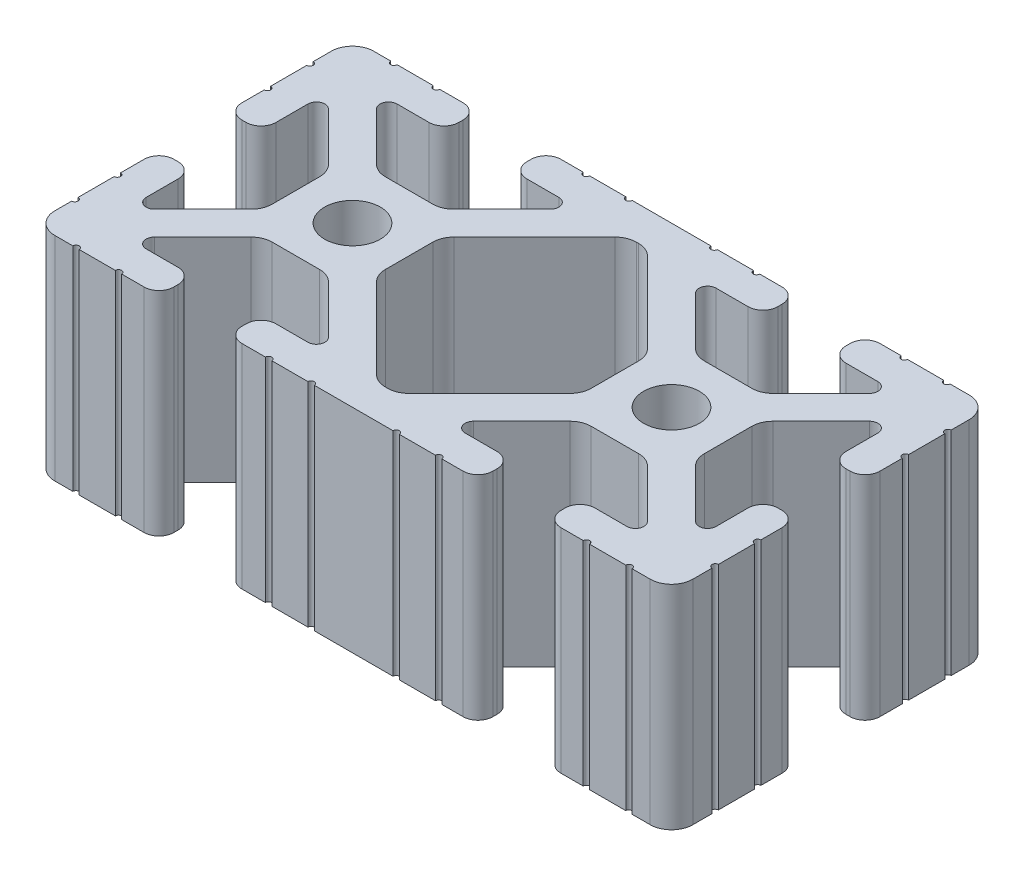
from build123d import *

# Parameters (mm, degrees)
SKETCH1_R           = 3.3274
BOSS_EXTRUDE1_DEPTH = 25.4


with BuildPart() as part:
    # Sketch1 → Boss-Extrude1 (new body)
    with BuildSketch(Plane(origin=(0, 0, 0), x_dir=(1, 0, 0), z_dir=(0, 1, 0))):
        with BuildLine():
            Line((27.420784407, 19.05), (24.892, 19.05))
            ThreePointArc((24.892, 19.05), (23.634764143, 18.529235857), (23.114, 17.272))
            Line((23.114, 17.272), (23.114, 16.764))
            ThreePointArc((23.114, 16.764), (23.634764143, 15.506764143), (24.892, 14.986))
            Line((24.892, 14.986), (28.709477062, 14.986))
            ThreePointArc((28.709477062, 14.986), (29.648138667, 14.358806367), (29.427897552, 13.25157951))
            Line((29.427897552, 13.25157951), (23.676666817, 7.500348776))
            ThreePointArc((23.676666817, 7.500348776), (22.852631511, 6.949745987), (21.880615593, 6.7564))
            Line((21.880615593, 6.7564), (16.219384407, 6.7564))
            ThreePointArc((16.219384407, 6.7564), (15.247368489, 6.949745987), (14.423333183, 7.500348776))
            Line((14.423333183, 7.500348776), (8.672102448, 13.25157951))
            ThreePointArc((8.672102448, 13.25157951), (8.451861333, 14.358806367), (9.390522938, 14.986))
            Line((9.390522938, 14.986), (13.208, 14.986))
            ThreePointArc((13.208, 14.986), (14.465235857, 15.506764143), (14.986, 16.764))
            Line((14.986, 16.764), (14.986, 17.272))
            ThreePointArc((14.986, 17.272), (14.465235857, 18.529235857), (13.208, 19.05))
            Line((13.208, 19.05), (10.541, 19.05))
            ThreePointArc((10.541, 19.05), (10.16, 18.669), (9.779, 19.05))
            Line((9.779, 19.05), (5.461, 19.05))
            ThreePointArc((5.461, 19.05), (5.08, 18.669), (4.699, 19.05))
            Line((4.699, 19.05), (-4.699, 19.05))
            ThreePointArc((-4.699, 19.05), (-5.08, 18.669), (-5.461, 19.05))
            Line((-5.461, 19.05), (-9.779, 19.05))
            ThreePointArc((-9.779, 19.05), (-10.16, 18.669), (-10.541, 19.05))
            Line((-10.541, 19.05), (-13.208, 19.05))
            ThreePointArc((-13.208, 19.05), (-14.465235857, 18.529235857), (-14.986, 17.272))
            Line((-14.986, 17.272), (-14.986, 16.764))
            ThreePointArc((-14.986, 16.764), (-14.465235857, 15.506764143), (-13.208, 14.986))
            Line((-13.208, 14.986), (-9.390522938, 14.986))
            ThreePointArc((-9.390522938, 14.986), (-8.451861333, 14.358806367), (-8.672102448, 13.25157951))
            Line((-8.672102448, 13.25157951), (-14.423333183, 7.500348776))
            ThreePointArc((-14.423333183, 7.500348776), (-15.247368489, 6.949745987), (-16.219384407, 6.7564))
            Line((-16.219384407, 6.7564), (-21.880615593, 6.7564))
            ThreePointArc((-21.880615593, 6.7564), (-22.852631511, 6.949745987), (-23.676666817, 7.500348776))
            Line((-23.676666817, 7.500348776), (-29.427897552, 13.25157951))
            ThreePointArc((-29.427897552, 13.25157951), (-29.648138667, 14.358806367), (-28.709477062, 14.986))
            Line((-28.709477062, 14.986), (-24.892, 14.986))
            ThreePointArc((-24.892, 14.986), (-23.634764143, 15.506764143), (-23.114, 16.764))
            Line((-23.114, 16.764), (-23.114, 17.272))
            ThreePointArc((-23.114, 17.272), (-23.634764143, 18.529235857), (-24.892, 19.05))
            Line((-24.892, 19.05), (-27.697215593, 19.05))
            ThreePointArc((-27.697215593, 19.05), (-28.078215593, 18.669), (-28.459215593, 19.05))
            Line((-28.459215593, 19.05), (-32.777215593, 19.05))
            ThreePointArc((-32.777215593, 19.05), (-33.158215593, 18.669), (-33.539215593, 19.05))
            Line((-33.539215593, 19.05), (-35.56, 19.05))
            ThreePointArc((-35.56, 19.05), (-37.356051224, 18.306051224), (-38.1, 16.51))
            Line((-38.1, 16.51), (-38.1, 14.351))
            ThreePointArc((-38.1, 14.351), (-37.719, 13.97), (-38.1, 13.589))
            Line((-38.1, 13.589), (-38.1, 9.271))
            ThreePointArc((-38.1, 9.271), (-37.719, 8.89), (-38.1, 8.509))
            Line((-38.1, 8.509), (-38.1, 5.842))
            ThreePointArc((-38.1, 5.842), (-37.579235857, 4.584764143), (-36.322, 4.064))
            Line((-36.322, 4.064), (-35.814, 4.064))
            ThreePointArc((-35.814, 4.064), (-34.556764143, 4.584764143), (-34.036, 5.842))
            Line((-34.036, 5.842), (-34.036, 9.659477062))
            ThreePointArc((-34.036, 9.659477062), (-33.408806367, 10.598138667), (-32.30157951, 10.377897552))
            Line((-32.30157951, 10.377897552), (-26.550348776, 4.626666817))
            ThreePointArc((-26.550348776, 4.626666817), (-25.999745987, 3.802631511), (-25.8064, 2.830615593))
            Line((-25.8064, 2.830615593), (-25.8064, -2.830615593))
            ThreePointArc((-25.8064, -2.830615593), (-25.999745987, -3.802631511), (-26.550348776, -4.626666817))
            Line((-26.550348776, -4.626666817), (-32.30157951, -10.377897552))
            ThreePointArc((-32.30157951, -10.377897552), (-33.408806367, -10.598138667), (-34.036, -9.659477062))
            Line((-34.036, -9.659477062), (-34.036, -5.842))
            ThreePointArc((-34.036, -5.842), (-34.556764143, -4.584764143), (-35.814, -4.064))
            Line((-35.814, -4.064), (-36.322, -4.064))
            ThreePointArc((-36.322, -4.064), (-37.579235857, -4.584764143), (-38.1, -5.842))
            Line((-38.1, -5.842), (-38.1, -8.647215593))
            ThreePointArc((-38.1, -8.647215593), (-37.719, -9.028215593), (-38.1, -9.409215593))
            Line((-38.1, -9.409215593), (-38.1, -13.727215593))
            ThreePointArc((-38.1, -13.727215593), (-37.719, -14.108215593), (-38.1, -14.489215593))
            Line((-38.1, -14.489215593), (-38.1, -16.51))
            ThreePointArc((-38.1, -16.51), (-37.356051224, -18.306051224), (-35.56, -19.05))
            Line((-35.56, -19.05), (-33.401, -19.05))
            ThreePointArc((-33.401, -19.05), (-33.02, -18.669), (-32.639, -19.05))
            Line((-32.639, -19.05), (-28.321, -19.05))
            ThreePointArc((-28.321, -19.05), (-27.94, -18.669), (-27.559, -19.05))
            Line((-27.559, -19.05), (-24.892, -19.05))
            ThreePointArc((-24.892, -19.05), (-23.634764143, -18.529235857), (-23.114, -17.272))
            Line((-23.114, -17.272), (-23.114, -16.764))
            ThreePointArc((-23.114, -16.764), (-23.634764143, -15.506764143), (-24.892, -14.986))
            Line((-24.892, -14.986), (-28.709477062, -14.986))
            ThreePointArc((-28.709477062, -14.986), (-29.648138667, -14.358806367), (-29.427897552, -13.25157951))
            Line((-29.427897552, -13.25157951), (-23.676666817, -7.500348776))
            ThreePointArc((-23.676666817, -7.500348776), (-22.852631511, -6.949745987), (-21.880615593, -6.7564))
            Line((-21.880615593, -6.7564), (-16.219384407, -6.7564))
            ThreePointArc((-16.219384407, -6.7564), (-15.247368489, -6.949745987), (-14.423333183, -7.500348776))
            Line((-14.423333183, -7.500348776), (-8.672102448, -13.25157951))
            ThreePointArc((-8.672102448, -13.25157951), (-8.451861333, -14.358806367), (-9.390522938, -14.986))
            Line((-9.390522938, -14.986), (-13.208, -14.986))
            ThreePointArc((-13.208, -14.986), (-14.465235857, -15.506764143), (-14.986, -16.764))
            Line((-14.986, -16.764), (-14.986, -17.272))
            ThreePointArc((-14.986, -17.272), (-14.465235857, -18.529235857), (-13.208, -19.05))
            Line((-13.208, -19.05), (-10.402784407, -19.05))
            ThreePointArc((-10.402784407, -19.05), (-10.021784407, -18.669), (-9.640784407, -19.05))
            Line((-9.640784407, -19.05), (-5.322784407, -19.05))
            ThreePointArc((-5.322784407, -19.05), (-4.941784407, -18.669), (-4.560784407, -19.05))
            Line((-4.560784407, -19.05), (4.837215593, -19.05))
            ThreePointArc((4.837215593, -19.05), (5.218215593, -18.669), (5.599215593, -19.05))
            Line((5.599215593, -19.05), (9.917215593, -19.05))
            ThreePointArc((9.917215593, -19.05), (10.298215593, -18.669), (10.679215593, -19.05))
            Line((10.679215593, -19.05), (13.208, -19.05))
            ThreePointArc((13.208, -19.05), (14.465235857, -18.529235857), (14.986, -17.272))
            Line((14.986, -17.272), (14.986, -16.764))
            ThreePointArc((14.986, -16.764), (14.465235857, -15.506764143), (13.208, -14.986))
            Line((13.208, -14.986), (9.390522938, -14.986))
            ThreePointArc((9.390522938, -14.986), (8.451861333, -14.358806367), (8.672102448, -13.25157951))
            Line((8.672102448, -13.25157951), (14.423333183, -7.500348776))
            ThreePointArc((14.423333183, -7.500348776), (15.247368489, -6.949745987), (16.219384407, -6.7564))
            Line((16.219384407, -6.7564), (21.880615593, -6.7564))
            ThreePointArc((21.880615593, -6.7564), (22.852631511, -6.949745987), (23.676666817, -7.500348776))
            Line((23.676666817, -7.500348776), (29.427897552, -13.25157951))
            ThreePointArc((29.427897552, -13.25157951), (29.648138667, -14.358806367), (28.709477062, -14.986))
            Line((28.709477062, -14.986), (24.892, -14.986))
            ThreePointArc((24.892, -14.986), (23.634764143, -15.506764143), (23.114, -16.764))
            Line((23.114, -16.764), (23.114, -17.272))
            ThreePointArc((23.114, -17.272), (23.634764143, -18.529235857), (24.892, -19.05))
            Line((24.892, -19.05), (27.559, -19.05))
            ThreePointArc((27.559, -19.05), (27.94, -18.669), (28.321, -19.05))
            Line((28.321, -19.05), (32.639, -19.05))
            ThreePointArc((32.639, -19.05), (33.02, -18.669), (33.401, -19.05))
            Line((33.401, -19.05), (35.56, -19.05))
            ThreePointArc((35.56, -19.05), (37.356051224, -18.306051224), (38.1, -16.51))
            Line((38.1, -16.51), (38.1, -14.212784407))
            ThreePointArc((38.1, -14.212784407), (37.719, -13.831784407), (38.1, -13.450784407))
            Line((38.1, -13.450784407), (38.1, -9.132784407))
            ThreePointArc((38.1, -9.132784407), (37.719, -8.751784407), (38.1, -8.370784407))
            Line((38.1, -8.370784407), (38.1, -5.842))
            ThreePointArc((38.1, -5.842), (37.579235857, -4.584764143), (36.322, -4.064))
            Line((36.322, -4.064), (35.814, -4.064))
            ThreePointArc((35.814, -4.064), (34.556764143, -4.584764143), (34.036, -5.842))
            Line((34.036, -5.842), (34.036, -9.659477062))
            ThreePointArc((34.036, -9.659477062), (33.408806367, -10.598138667), (32.30157951, -10.377897552))
            Line((32.30157951, -10.377897552), (26.550348776, -4.626666817))
            ThreePointArc((26.550348776, -4.626666817), (25.999745987, -3.802631511), (25.8064, -2.830615593))
            Line((25.8064, -2.830615593), (25.8064, 2.830615593))
            ThreePointArc((25.8064, 2.830615593), (25.999745987, 3.802631511), (26.550348776, 4.626666817))
            Line((26.550348776, 4.626666817), (32.30157951, 10.377897552))
            ThreePointArc((32.30157951, 10.377897552), (33.408806367, 10.598138667), (34.036, 9.659477062))
            Line((34.036, 9.659477062), (34.036, 5.842))
            ThreePointArc((34.036, 5.842), (34.556764143, 4.584764143), (35.814, 4.064))
            Line((35.814, 4.064), (36.322, 4.064))
            ThreePointArc((36.322, 4.064), (37.579235857, 4.584764143), (38.1, 5.842))
            Line((38.1, 5.842), (38.1, 8.509))
            ThreePointArc((38.1, 8.509), (37.719, 8.89), (38.1, 9.271))
            Line((38.1, 9.271), (38.1, 13.589))
            ThreePointArc((38.1, 13.589), (37.719, 13.97), (38.1, 14.351))
            Line((38.1, 14.351), (38.1, 16.51))
            ThreePointArc((38.1, 16.51), (37.356051224, 18.306051224), (35.56, 19.05))
            Line((35.56, 19.05), (33.262784407, 19.05))
            ThreePointArc((33.262784407, 19.05), (32.881784407, 18.669), (32.500784407, 19.05))
            Line((32.500784407, 19.05), (28.182784407, 19.05))
            ThreePointArc((28.182784407, 19.05), (27.801784407, 18.669), (27.420784407, 19.05))
        make_face()
        with Locations(Location((19.05, 0, 0), (0, 0, 270))):
            Circle(SKETCH1_R, mode=Mode.SUBTRACT)
        with Locations(Location((-19.05, 0, 0), (0, 0, 270))):
            Circle(SKETCH1_R, mode=Mode.SUBTRACT)
        with BuildLine():
            Line((-12.2936, -2.830615593), (-12.2936, 2.830615593))
            ThreePointArc((-12.2936, 2.830615593), (-12.100254013, 3.802631511), (-11.549651224, 4.626666817))
            Line((-11.549651224, 4.626666817), (-1.934266817, 14.242051224))
            ThreePointArc((-1.934266817, 14.242051224), (-1.110231511, 14.792654013), (-0.138215593, 14.986))
            Line((-0.138215593, 14.986), (0.138215593, 14.986))
            ThreePointArc((0.138215593, 14.986), (1.110231511, 14.792654013), (1.934266817, 14.242051224))
            Line((1.934266817, 14.242051224), (11.549651224, 4.626666817))
            ThreePointArc((11.549651224, 4.626666817), (12.100254013, 3.802631511), (12.2936, 2.830615593))
            Line((12.2936, 2.830615593), (12.2936, -2.830615593))
            ThreePointArc((12.2936, -2.830615593), (12.100254013, -3.802631511), (11.549651224, -4.626666817))
            Line((11.549651224, -4.626666817), (1.934266817, -14.242051224))
            ThreePointArc((1.934266817, -14.242051224), (1.110231511, -14.792654013), (0.138215593, -14.986))
            Line((0.138215593, -14.986), (-0.138215593, -14.986))
            ThreePointArc((-0.138215593, -14.986), (-1.110231511, -14.792654013), (-1.934266817, -14.242051224))
            Line((-1.934266817, -14.242051224), (-11.549651224, -4.626666817))
            ThreePointArc((-11.549651224, -4.626666817), (-12.100254013, -3.802631511), (-12.2936, -2.830615593))
        make_face(mode=Mode.SUBTRACT)
    extrude(amount=BOSS_EXTRUDE1_DEPTH)


solid = part.part
